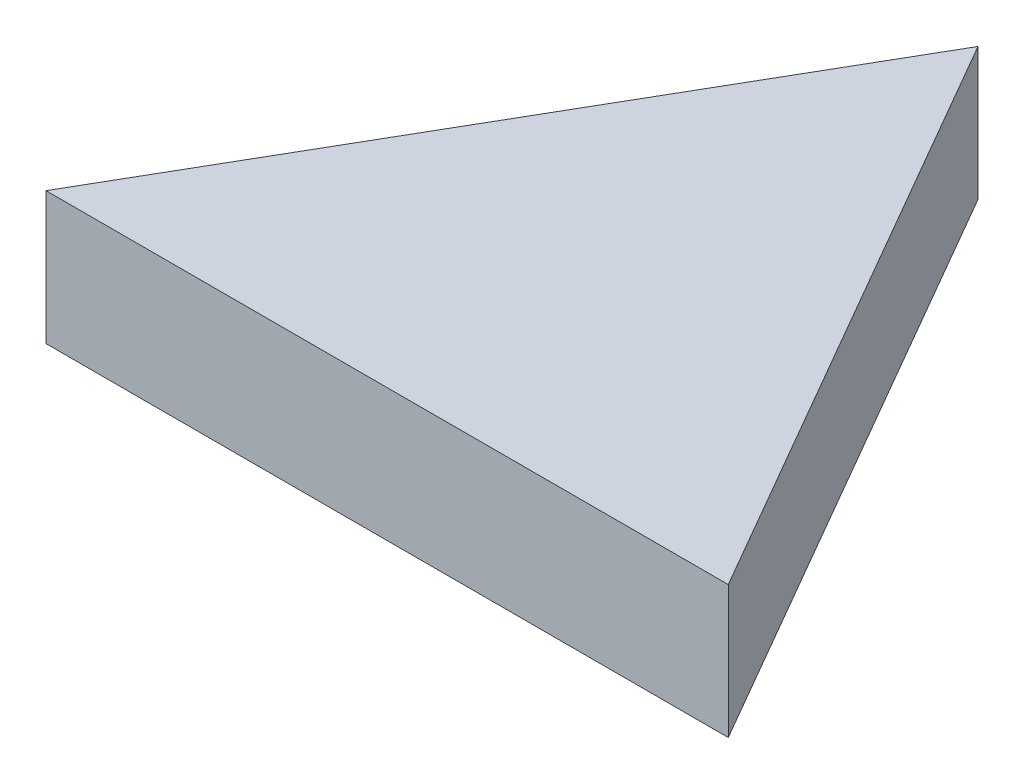
from build123d import *

# Parameters (mm, degrees)
BOSS_EXTRUDE1_DEPTH = 360


with BuildPart() as part:
    # Sketch1 → Boss-Extrude1 (new body)
    with BuildSketch(Plane(origin=(0, 0, 0), x_dir=(1, 0, 0), z_dir=(0, 1, 0))):
        Polygon((0, 0), (1854.06, 0), (927.03, 1605.663060141), align=None)
    extrude(amount=BOSS_EXTRUDE1_DEPTH)


solid = part.part
